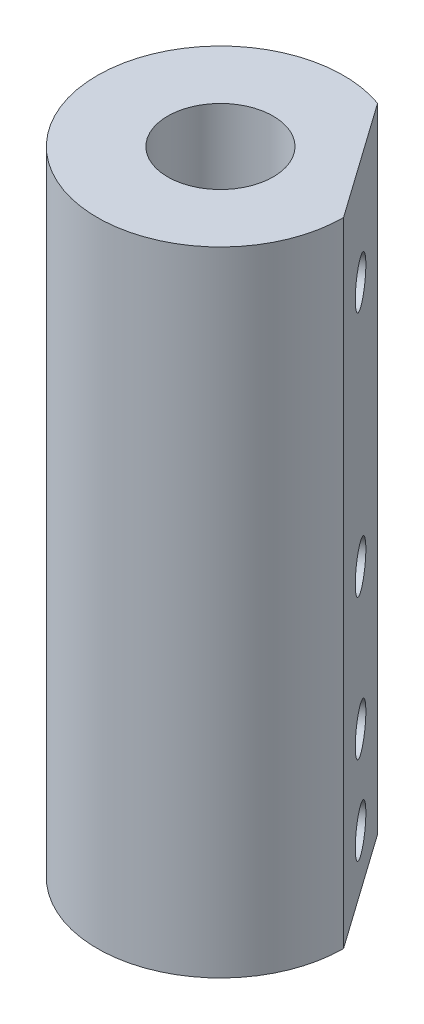
from build123d import *

# Parameters (mm, degrees)
SKETCH1_R               = 11.1125
SKETCH1_R_2             = 3.175
BOSS_EXTRUDE1_DEPTH     = 57.15
CUT_EXTRUDE2_DEPTH      = 60.271391181
CUT_EXTRUDE2_DEPTH_BACK = 57.15
SKETCH3_R               = 4.7625
CUT_EXTRUDE3_DEPTH      = 38.1
CUT_EXTRUDE4_REACH      = 64.262
SKETCH4_R               = 1.984375


with BuildPart() as part:
    # Sketch1 → Boss-Extrude1 (new body)
    with BuildSketch(Plane(origin=(0, 0, 0), x_dir=(1, 0, 0), z_dir=(0, 1, 0))):
        with Locations(Location((0, 0, 0), (0, 0, 270))):
            Circle(SKETCH1_R)
        with Locations(Location((0, 0, 0), (0, 0, 270))):
            Circle(SKETCH1_R_2, mode=Mode.SUBTRACT)
    extrude(amount=BOSS_EXTRUDE1_DEPTH)

    # Sketch2 → Cut-Extrude2 (cut, two sides: drawn at the far end of the back side and taken through both)
    with BuildSketch(Plane(origin=(0, 57.15, 0), x_dir=(1, 0, 0), z_dir=(0, 1, 0)).offset(-CUT_EXTRUDE2_DEPTH_BACK)):
        Polygon((-32.277943168, 61.417010445), (3.712797685, 10.473909948), (11.1125, 0), (47.103240854, -50.943100497), (148.989441847, 21.03838121), (69.608257825, 133.398492152), align=None)
    extrude(amount=CUT_EXTRUDE2_DEPTH + CUT_EXTRUDE2_DEPTH_BACK, mode=Mode.SUBTRACT)

    # Sketch3 → Cut-Extrude3 (cut)
    with BuildSketch(Plane(origin=(0, 57.15, 0), x_dir=(1, 0, 0), z_dir=(0, 1, 0))):
        with Locations(Location((0, 0, 0), (0, 0, 270))):
            Circle(SKETCH3_R)
    extrude(amount=-CUT_EXTRUDE3_DEPTH, mode=Mode.SUBTRACT)

    # Sketch4 → Cut-Extrude4 (cut, up to next)
    with BuildSketch(Plane(origin=(7.412648843, 0, -5.236954974), x_dir=(-0.5770138525497868, 0, -0.8167343594863956), z_dir=(0.8167343594863956, 0, -0.5770138525497868)), mode=Mode.PRIVATE) as cut_extrude4_sk1:
        with Locations((0, 47.625)):
            Circle(SKETCH4_R)
    cut_extrude4_tool1 = extrude(cut_extrude4_sk1.sketch, amount=-CUT_EXTRUDE4_REACH, mode=Mode.PRIVATE) & part.part
    # Sketch4 → Cut-Extrude4 (cut, up to next)
    with BuildSketch(Plane(origin=(7.412648843, 0, -5.236954974), x_dir=(-0.5770138525497868, 0, -0.8167343594863956), z_dir=(0.8167343594863956, 0, -0.5770138525497868)), mode=Mode.PRIVATE) as cut_extrude4_sk2:
        with Locations((0, 25.4)):
            Circle(SKETCH4_R)
    cut_extrude4_tool2 = extrude(cut_extrude4_sk2.sketch, amount=-CUT_EXTRUDE4_REACH, mode=Mode.PRIVATE) & part.part
    # Sketch4 → Cut-Extrude4 (cut, up to next)
    with BuildSketch(Plane(origin=(7.412648843, 0, -5.236954974), x_dir=(-0.5770138525497868, 0, -0.8167343594863956), z_dir=(0.8167343594863956, 0, -0.5770138525497868)), mode=Mode.PRIVATE) as cut_extrude4_sk3:
        with Locations((0, 12.7)):
            Circle(SKETCH4_R)
    cut_extrude4_tool3 = extrude(cut_extrude4_sk3.sketch, amount=-CUT_EXTRUDE4_REACH, mode=Mode.PRIVATE) & part.part
    # Sketch4 → Cut-Extrude4 (cut, up to next)
    with BuildSketch(Plane(origin=(7.412648843, 0, -5.236954974), x_dir=(-0.5770138525497868, 0, -0.8167343594863956), z_dir=(0.8167343594863956, 0, -0.5770138525497868)), mode=Mode.PRIVATE) as cut_extrude4_sk4:
        with Locations((0, 4.7625)):
            Circle(SKETCH4_R)
    cut_extrude4_tool4 = extrude(cut_extrude4_sk4.sketch, amount=-CUT_EXTRUDE4_REACH, mode=Mode.PRIVATE) & part.part
    add(cut_extrude4_tool1.solids().sort_by_distance((7.412649, 47.625, -5.236955))[0], mode=Mode.SUBTRACT)
    add(cut_extrude4_tool2.solids().sort_by_distance((7.412649, 25.4, -5.236955))[0], mode=Mode.SUBTRACT)
    add(cut_extrude4_tool3.solids().sort_by_distance((7.412649, 12.7, -5.236955))[0], mode=Mode.SUBTRACT)
    add(cut_extrude4_tool4.solids().sort_by_distance((7.412649, 4.7625, -5.236955))[0], mode=Mode.SUBTRACT)


solid = part.part
